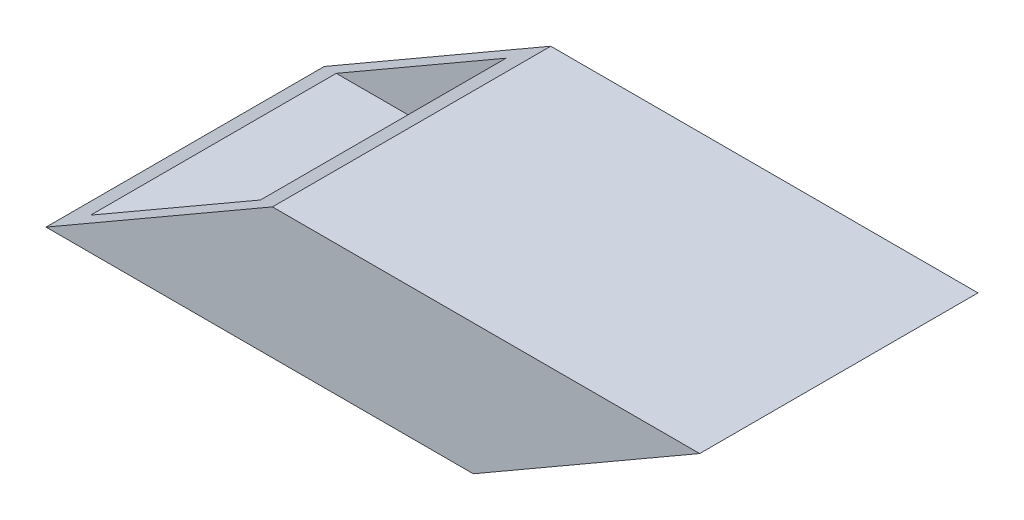
from build123d import *

# Parameters (mm, degrees)
SKETCH1_W           = 42.57
SKETCH1_H           = 20
BOSS_EXTRUDE1_DEPTH = 100
SKETCH2_W           = 37.57
SKETCH2_H           = 15
CUT_EXTRUDE1_DEPTH  = 111.508845347
CUT_EXTRUDE2_DEPTH  = 111.508845347


with BuildPart() as part:
    # Sketch1 → Boss-Extrude1 (new body)
    with BuildSketch(Plane(origin=(0, 0, 0), x_dir=(0, 0, -1), z_dir=(1, 0, 0))):
        with Locations((21.285, 10)):
            Rectangle(SKETCH1_W, SKETCH1_H)
    extrude(amount=BOSS_EXTRUDE1_DEPTH)

    # Sketch2 → Cut-Extrude1 (cut, through all)
    with BuildSketch(Plane.ZY):
        with Locations((-21.285, 10)):
            Rectangle(SKETCH2_W, SKETCH2_H)
    extrude(amount=-CUT_EXTRUDE1_DEPTH, mode=Mode.SUBTRACT)

    # Sketch3 → Cut-Extrude2 (cut, through all)
    with BuildSketch(Plane.XY):
        Polygon((0, 0), (34.641016151, 20), (0, 20), align=None)
        Polygon((100, 20), (65.358983849, 0), (100, 0), align=None)
    extrude(amount=-CUT_EXTRUDE2_DEPTH, mode=Mode.SUBTRACT)


solid = part.part
